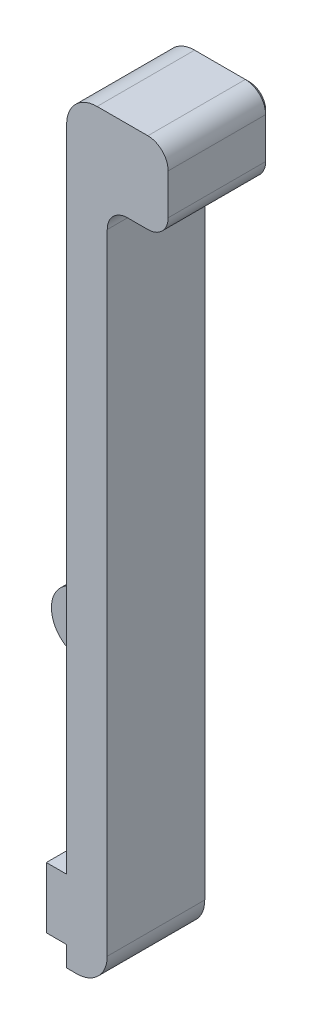
from build123d import *

# Parameters (mm, degrees)
SKETCH1_R           = 1.7
BOSS_EXTRUDE1_DEPTH = 12.7
SKETCH2_W           = 6.35
SKETCH2_H           = 10.16
CUT_EXTRUDE1_DEPTH  = 20.32
CHAMFER1_SIZE       = 0.5


with BuildPart() as part:
    # Sketch1 → Boss-Extrude1 (new body)
    with BuildSketch(Plane.XY):
        with BuildLine():
            Line((2.54, 47.625), (7.62, 47.625))
            ThreePointArc((7.62, 47.625), (9.416051224, 46.881051224), (10.16, 45.085))
            Line((10.16, 45.085), (10.16, 40.005))
            ThreePointArc((10.16, 40.005), (9.416051224, 38.208948776), (7.62, 37.465))
            Line((7.62, 37.465), (5.08, 37.465))
            ThreePointArc((5.08, 37.465), (3.283948776, 36.721051224), (2.54, 34.925))
            Line((2.54, 34.925), (2.54, -43.815))
            ThreePointArc((2.54, -43.815), (1.424076836, -46.509076836), (-1.27, -47.625))
            Line((-1.27, -47.625), (-2.54, -47.625))
            Line((-2.54, -47.625), (-2.54, -45.085))
            Line((-2.54, -45.085), (-5.08, -45.085))
            Line((-5.08, -45.085), (-5.08, -37.465))
            Line((-5.08, -37.465), (-2.54, -37.465))
            Line((-2.54, -37.465), (-2.54, -20.955))
            ThreePointArc((-2.54, -20.955), (-2.911974388, -20.056974388), (-3.81, -19.685))
            Line((-3.81, -19.685), (-6.985, -19.685))
            ThreePointArc((-6.985, -19.685), (-10.795, -15.875), (-6.985, -12.065))
            Line((-6.985, -12.065), (-3.81, -12.065))
            ThreePointArc((-3.81, -12.065), (-2.911974388, -11.693025612), (-2.54, -10.795))
            Line((-2.54, -10.795), (-2.54, 43.815))
            ThreePointArc((-2.54, 43.815), (-1.424076836, 46.509076836), (1.27, 47.625))
            Line((1.27, 47.625), (2.54, 47.625))
        make_face()
        with Locations((-6.985, -15.875)):
            Circle(SKETCH1_R, mode=Mode.SUBTRACT)
    extrude(amount=BOSS_EXTRUDE1_DEPTH)

    # Sketch2 → Cut-Extrude1 (cut)
    with BuildSketch(Plane.ZY.offset(2.54)):
        with Locations((9.525, -15.875)):
            Rectangle(SKETCH2_W, SKETCH2_H)
    extrude(amount=CUT_EXTRUDE1_DEPTH, mode=Mode.SUBTRACT)

    # Chamfer1
    chamfer1_edges = [part.edges().sort_by_distance(p)[0] for p in [
        (-3.81, -45.085, 0),
        (-5.08, -41.275, 0),
        (-3.81, -37.465, 0),
        (-2.54, -29.21, 0),
        (-2.911974388, -20.056974388, 0),
        (-5.3975, -19.685, 0),
        (-10.795, -15.875, 0),
        (-5.3975, -12.065, 0),
        (-2.911974388, -11.693025612, 0),
        (-2.54, 16.51, 0),
        (-1.424076836, 46.509076836, 0),
        (4.445, 47.625, 0),
        (9.416051224, 46.881051224, 0),
        (10.16, 42.545, 0),
        (9.416051224, 38.208948776, 0),
        (6.35, 37.465, 0),
        (3.283948776, 36.721051224, 0),
        (2.54, -4.445, 0),
        (1.424076836, -46.509076836, 0),
        (-1.905, -47.625, 0),
        (-2.54, -46.355, 0),
        (-8.685, -15.875, 0),
    ]]
    chamfer(chamfer1_edges, length=CHAMFER1_SIZE)


solid = part.part
